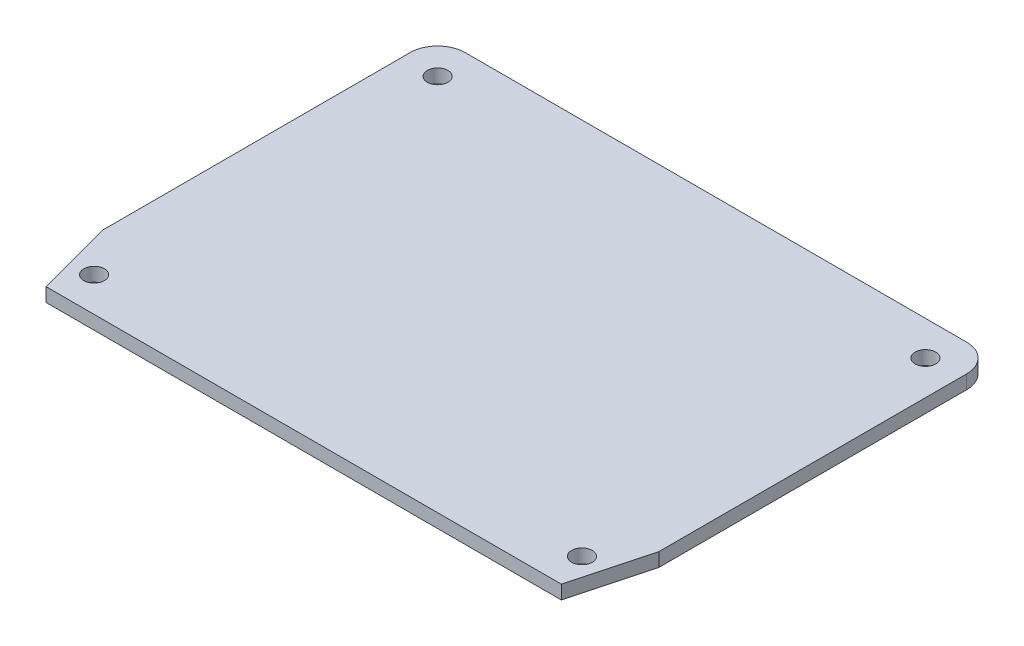
from build123d import *

# Parameters (mm, degrees)
SKETCH1_W           = 81
SKETCH1_H           = 60
BOSS_EXTRUDE1_DEPTH = 2
SKETCH2_R           = 1.5
CUT_EXTRUDE1_DEPTH  = 51.440559077
FILLET1_R           = 4
CHAMFER1_SIZE       = 3
CHAMFER1_SIZE2      = 11.196152423
CHAMFER2_SIZE       = 3
CHAMFER2_SIZE2      = 11.196152423


with BuildPart() as part:
    # Sketch1 → Boss-Extrude1 (new body)
    with BuildSketch(Plane(origin=(0, 0, 0), x_dir=(1, 0, 0), z_dir=(0, 1, 0))):
        Rectangle(SKETCH1_W, SKETCH1_H)
    extrude(amount=BOSS_EXTRUDE1_DEPTH)

    # Sketch2 → Cut-Extrude1 (cut, through all)
    with BuildSketch(Plane(origin=(0, 2, 0), x_dir=(1, 0, 0), z_dir=(0, 1, 0))):
        with Locations(Location((-35.5, -25, 0), (0, 0, 270))):
            Circle(SKETCH2_R)
        with Locations(Location((35.5, -25, 0), (0, 0, 270))):
            Circle(SKETCH2_R)
        with Locations(Location((-35.5, 25, 0), (0, 0, 270))):
            Circle(SKETCH2_R)
        with Locations(Location((35.5, 25, 0), (0, 0, 270))):
            Circle(SKETCH2_R)
    extrude(amount=-CUT_EXTRUDE1_DEPTH, mode=Mode.SUBTRACT)

    # Fillet1
    fillet1_edges = [part.edges().sort_by_distance(p)[0] for p in [
        (-40.5, 1, -30),
        (40.5, 1, -30),
    ]]
    fillet(fillet1_edges, radius=FILLET1_R)

    # Chamfer1
    chamfer1_edges = [part.edges().sort_by_distance(p)[0] for p in [
        (40.5, 1, 30),
    ]]
    chamfer1_side = [part.faces().sort_by_distance(p)[0] for p in [
        (0, 1, 30),
    ]]
    chamfer(chamfer1_edges, length=CHAMFER1_SIZE, length2=CHAMFER1_SIZE2, reference=chamfer1_side[0])

    # Chamfer2
    chamfer2_edges = [part.edges().sort_by_distance(p)[0] for p in [
        (-40.5, 1, 30),
    ]]
    chamfer2_side = [part.faces().sort_by_distance(p)[0] for p in [
        (-1.5, 1, 30),
    ]]
    chamfer(chamfer2_edges, length=CHAMFER2_SIZE, length2=CHAMFER2_SIZE2, reference=chamfer2_side[0])


solid = part.part
